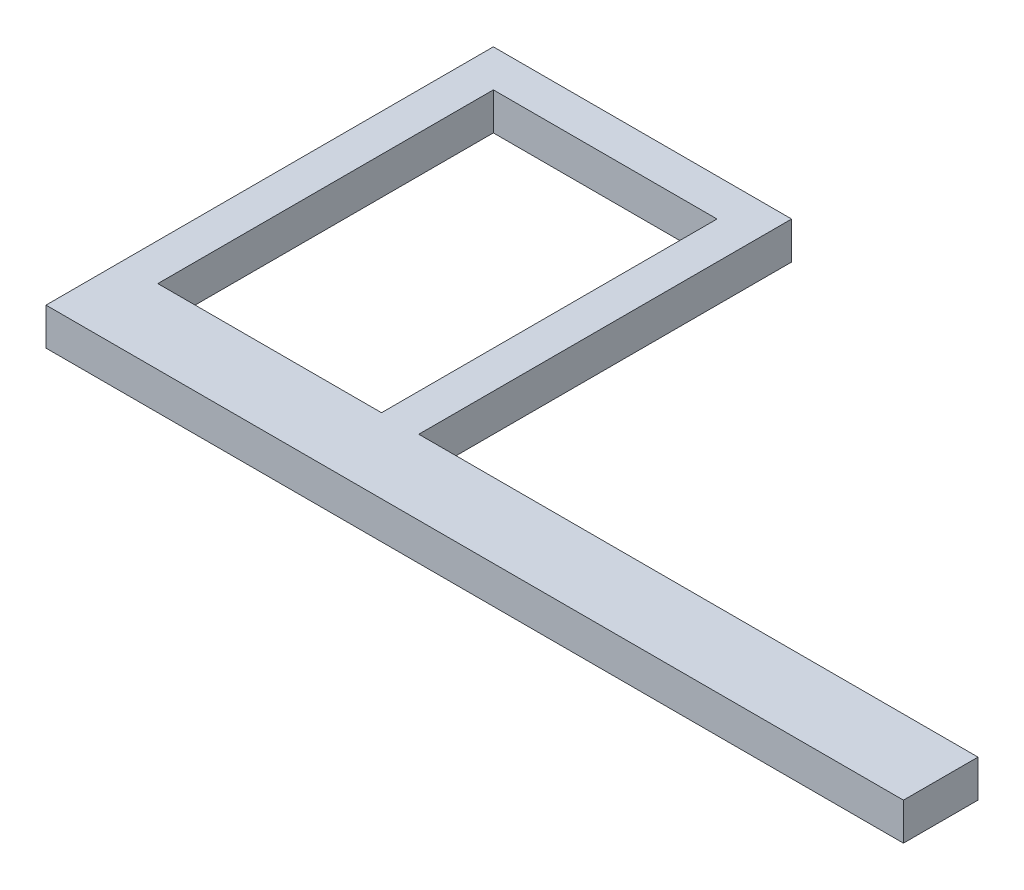
from build123d import *

# Parameters (mm, degrees)
BOSS_EXTRU_1_DEPTH      = 5
ESQUISSE7_W             = 30
ESQUISSE7_H             = 45
ENL_V_MAT_EXTRU_2_DEPTH = 121.194984953


with BuildPart() as part:
    # Esquisse1 → Boss.-Extru.1 (new body)
    with BuildSketch(Plane(origin=(0, 0, 0), x_dir=(1, 0, 0), z_dir=(0, 1, 0))):
        Polygon((-109.905109489, 48.401459854), (-109.905109489, -11.598540146), (5.094890511, -11.598540146), (5.094890511, -1.598540146), (-69.905109489, -1.598540146), (-69.905109489, 48.401459854), align=None)
    extrude(amount=BOSS_EXTRU_1_DEPTH)

    # Esquisse7 → Enlèv. mat.-Extru.2 (cut, through all)
    with BuildSketch(Plane(origin=(0, 5, 0), x_dir=(1, 0, 0), z_dir=(0, 1, 0))):
        with Locations((-89.905109489, 20.901459854)):
            Rectangle(ESQUISSE7_W, ESQUISSE7_H)
    extrude(amount=-ENL_V_MAT_EXTRU_2_DEPTH, mode=Mode.SUBTRACT)


solid = part.part
